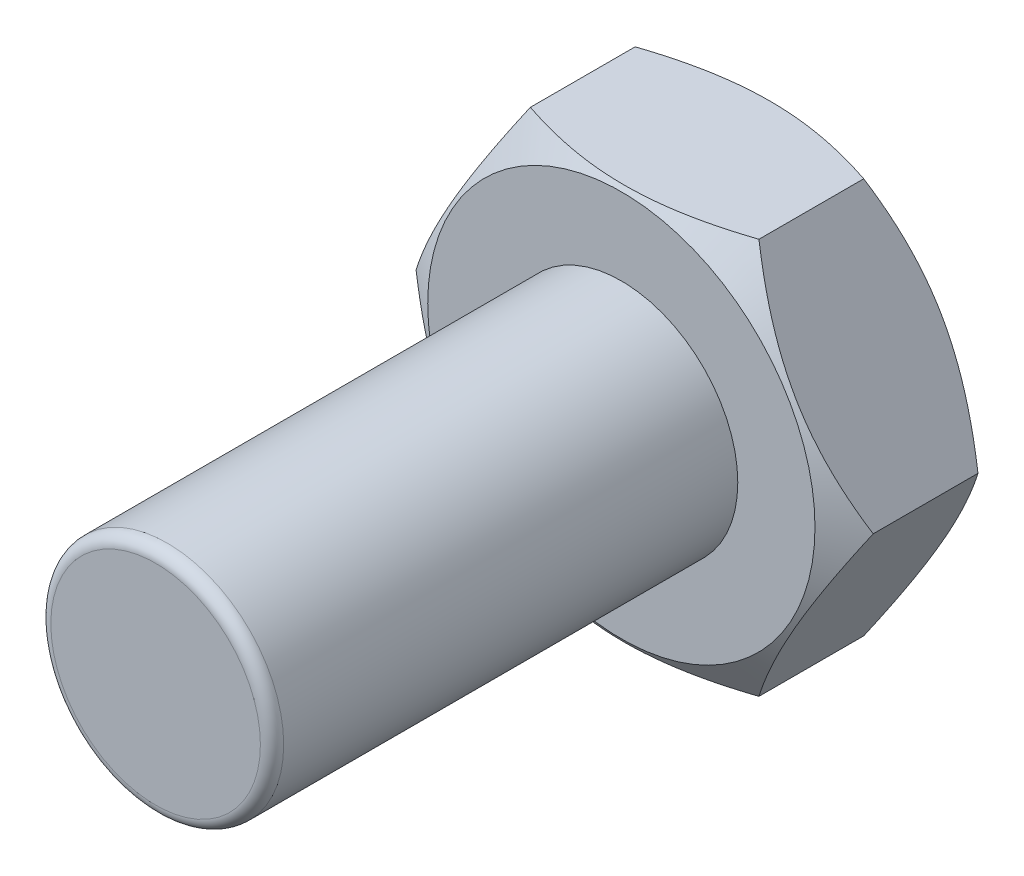
from build123d import *

# Parameters (mm, degrees)
Y_KSEKLIK_EKSTR_ZYON1_DEPTH = 6.5
IZIM2_R                     = 5
Y_KSEKLIK_EKSTR_ZYON2_DEPTH = 20
RADYUS1_R                   = 0.5


with BuildPart() as part:
    # Çizim1 → Yükseklik-Ekstrüzyon1 (new body)
    with BuildSketch(Plane.XY):
        Polygon((9.814954576, 0), (4.907477288, 8.5), (-4.907477288, 8.5), (-9.814954576, 0), (-4.907477288, -8.5), (4.907477288, -8.5), align=None)
    extrude(amount=Y_KSEKLIK_EKSTR_ZYON1_DEPTH)

    # Çizim2 → Yükseklik-Ekstrüzyon2 (add)
    with BuildSketch(Plane.XY.offset(6.5)):
        Circle(IZIM2_R)
    extrude(amount=Y_KSEKLIK_EKSTR_ZYON2_DEPTH)

    # Çizim3 → Kes-Döndür1 (revolve, cut)
    with BuildSketch(Plane(origin=(0, 0, 0), x_dir=(1, 0, 0), z_dir=(0, 1, 0))):
        Polygon((-9.814954576, 0), (-8.314954576, 0), (-9.814954576, -1), align=None)
        Polygon((-9.814954576, -6.5), (-9.814954576, -5.5), (-8.314954576, -6.5), align=None)
    revolve(axis=Axis((0, 0, 0), (0, 0, 1)), mode=Mode.SUBTRACT)

    # Radyus1
    radyus1_edges = [part.edges().sort_by_distance(p)[0] for p in [
        (-5, 0, 26.5),
    ]]
    fillet(radyus1_edges, radius=RADYUS1_R)


solid = part.part
